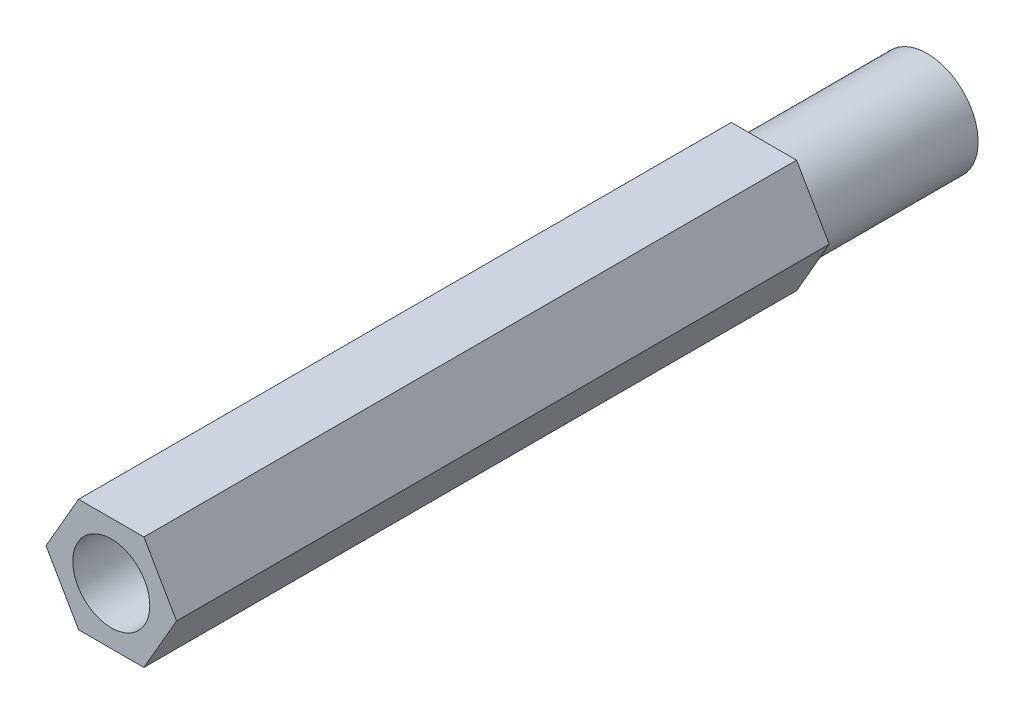
from build123d import *

# Parameters (mm, degrees)
BOSS_EXTRUDE1_DEPTH = 63.5
SKETCH2_R           = 2.9972
CUT_EXTRUDE1_DEPTH  = 12.7
SKETCH3_R           = 3.96875
CUT_EXTRUDE2_DEPTH  = 12.7
SKETCH4_R           = 1.27
CUT_EXTRUDE3_DEPTH  = 5.08


with BuildPart() as part:
    # Sketch1 → Boss-Extrude1 (new body)
    with BuildSketch(Plane.XY):
        Polygon((5.08, 0), (2.54, 4.399409051), (-2.54, 4.399409051), (-5.08, 0), (-2.54, -4.399409051), (2.54, -4.399409051), align=None)
    extrude(amount=BOSS_EXTRUDE1_DEPTH)

    # Sketch2 → Cut-Extrude1 (cut)
    with BuildSketch(Plane.XY.offset(63.5)):
        Circle(SKETCH2_R)
    extrude(amount=-CUT_EXTRUDE1_DEPTH, mode=Mode.SUBTRACT)

    # Sketch3 → Cut-Extrude2 (cut)
    with BuildSketch(Plane(origin=(0, 0, 0), x_dir=(-1, 0, 0), z_dir=(0, 0, -1))):
        Polygon((5.08, 0), (2.54, 4.399409051), (-2.54, 4.399409051), (-5.08, 0), (-2.54, -4.399409051), (2.54, -4.399409051), align=None)
        Circle(SKETCH3_R, mode=Mode.SUBTRACT)
    extrude(amount=-CUT_EXTRUDE2_DEPTH, mode=Mode.SUBTRACT)

    # Sketch4 → Cut-Extrude3 (cut)
    with BuildSketch(Plane(origin=(-3.81, 2.199704526, 0), x_dir=(0, 0, 1), z_dir=(-0.8660254037844385, 0.5000000000000004, 0))):
        with Locations(Location((57.15, 0, 0), (0, 0, 270))):
            Circle(SKETCH4_R)
    extrude(amount=-CUT_EXTRUDE3_DEPTH, mode=Mode.SUBTRACT)


solid = part.part
